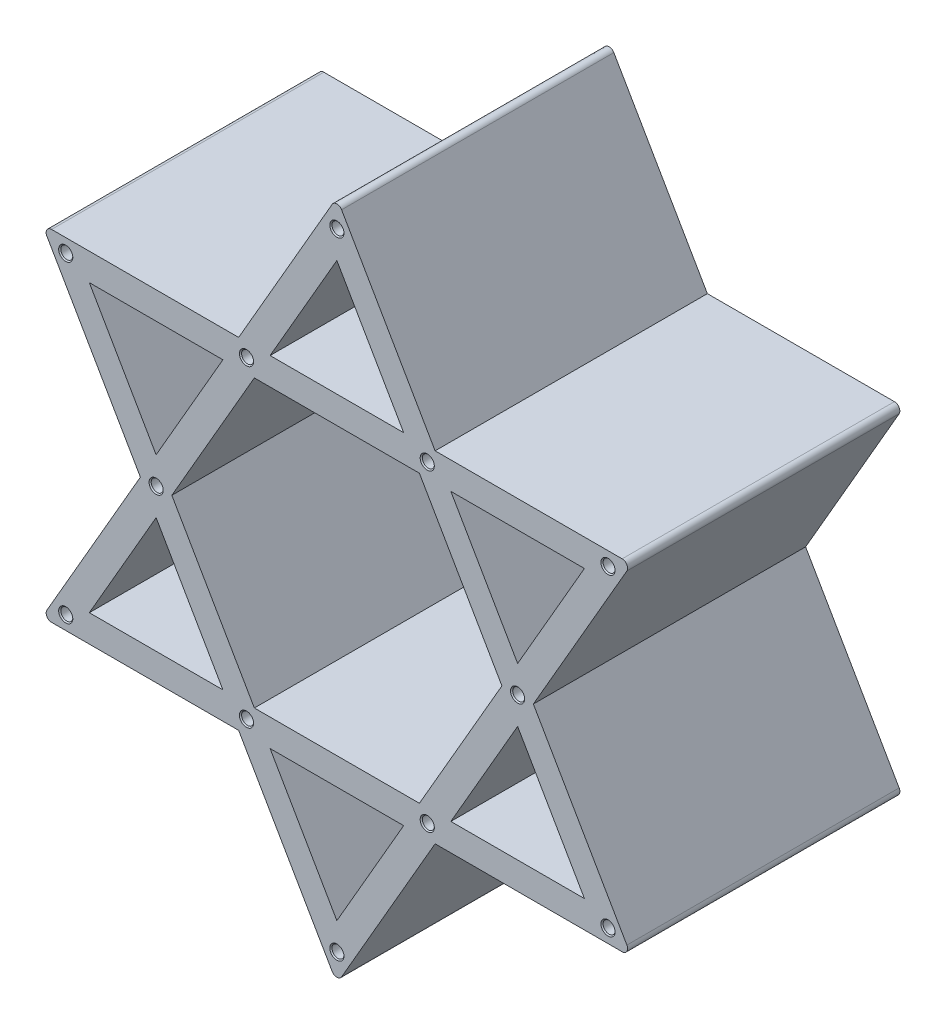
from build123d import *

# Parameters (mm, degrees)
EXTRUDE_1_DEPTH     = 100
FILLET_1_R          = 2
SKETCH_2_R          = 2.2
CUT_EXTRUDE_1_DEPTH = 12
CHAMFER_1_SIZE      = 0.4


with BuildPart() as part:
    # Эскиз1 → Бобышка-Вытянуть1 (new body)
    with BuildSketch(Plane.XY):
        Polygon((0, 125), (-36.084391824, 62.5), (-108.253175473, 62.5), (-72.168783649, 0), (-108.253175473, -62.5), (-36.084391824, -62.5), (0, -125), (36.084391824, -62.5), (108.253175473, -62.5), (72.168783649, 0), (108.253175473, 62.5), (36.084391824, 62.5), align=None)
        Polygon((0, 105), (-24.537386441, 62.5), (24.537386441, 62.5), align=None, mode=Mode.SUBTRACT)
        Polygon((-90.932667397, -52.5), (-41.857894516, -52.5), (-66.395280957, -10), align=None, mode=Mode.SUBTRACT)
        Polygon((90.932667397, -52.5), (66.395280957, -10), (41.857894516, -52.5), align=None, mode=Mode.SUBTRACT)
        Polygon((-90.932667397, 52.5), (-41.857894516, 52.5), (-66.395280957, 10), align=None, mode=Mode.SUBTRACT)
        Polygon((90.932667397, 52.5), (66.395280957, 10), (41.857894516, 52.5), align=None, mode=Mode.SUBTRACT)
        Polygon((0, -105), (-24.537386441, -62.5), (24.537386441, -62.5), align=None, mode=Mode.SUBTRACT)
        Polygon((-30.310889132, 52.5), (30.310889132, 52.5), (60.621778265, 0), (30.310889132, -52.5), (-30.310889132, -52.5), (-60.621778265, 0), align=None, mode=Mode.SUBTRACT)
    extrude(amount=EXTRUDE_1_DEPTH)

    # Скругление1
    fillet_1_edges = [part.edges().sort_by_distance(p)[0] for p in [
        (108.253175473, 62.5, 50),
        (108.253175473, -62.5, 50),
        (0, -125, 50),
        (-108.253175473, -62.5, 50),
        (-108.253175473, 62.5, 50),
        (0, 125, 50),
    ]]
    fillet(fillet_1_edges, radius=FILLET_1_R)

    # Эскиз2 → Вырез-Вытянуть1 (cut)
    with BuildSketch(Plane.XY.offset(100)):
        with Locations((0, 115)):
            Circle(SKETCH_2_R)
        with Locations((-99.592921435, -57.5)):
            Circle(SKETCH_2_R)
        with Locations((99.592921435, -57.5)):
            Circle(SKETCH_2_R)
        with Locations((-33.197640478, 57.5)):
            Circle(SKETCH_2_R)
        with Locations((33.197640478, 57.5)):
            Circle(SKETCH_2_R)
        with Locations(Location((-99.592921435, 57.5, 0), (0, 0, 180))):
            Circle(SKETCH_2_R)
        with Locations(Location((99.592921435, 57.5, 0), (0, 0, 180))):
            Circle(SKETCH_2_R)
        with Locations(Location((33.197640478, -57.5, 0), (0, 0, 180))):
            Circle(SKETCH_2_R)
        with Locations(Location((-33.197640478, -57.5, 0), (0, 0, 180))):
            Circle(SKETCH_2_R)
        with Locations(Location((0, -115, 0), (0, 0, 180))):
            Circle(SKETCH_2_R)
        with Locations((-66.395280957, 0)):
            Circle(SKETCH_2_R)
        with Locations((66.395280957, 0)):
            Circle(SKETCH_2_R)
    extrude(amount=-CUT_EXTRUDE_1_DEPTH, mode=Mode.SUBTRACT)

    # Фаска1
    chamfer_1_edges = [part.edges().sort_by_distance(p)[0] for p in [
        (-2.2, 115, 100),
        (64.195280957, 0, 100),
        (-68.595280957, 0, 100),
        (2.2, -115, 100),
        (-101.792921435, -57.5, 100),
        (97.392921435, -57.5, 100),
        (-35.397640478, 57.5, 100),
        (30.997640478, 57.5, 100),
        (-97.392921435, 57.5, 100),
        (101.792921435, 57.5, 100),
        (35.397640478, -57.5, 100),
        (-30.997640478, -57.5, 100),
    ]]
    chamfer(chamfer_1_edges, length=CHAMFER_1_SIZE)


solid = part.part
